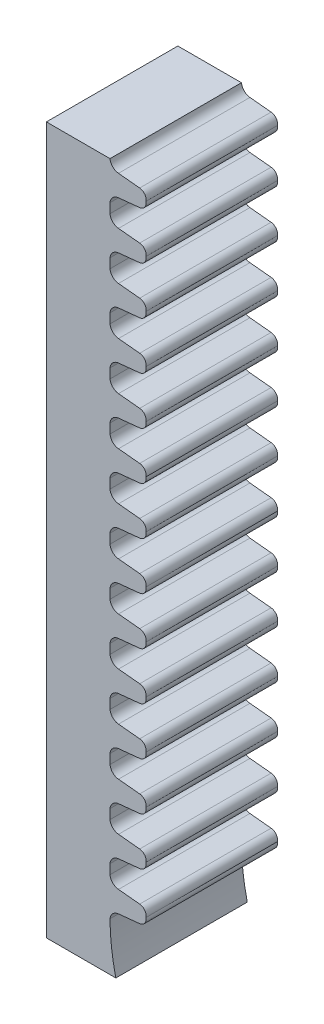
from build123d import *

# Parameters (mm, degrees)
BOSS_EXTRUDE1_DEPTH     = 6.2
BOSS_EXTRUDE3_DEPTH     = 6.2
CUT_EXTRUDE5_DEPTH      = 59.510170056
CUT_EXTRUDE5_DEPTH_BACK = 59.510170056
SKETCH9_W               = 8.426821026
SKETCH9_H               = 53.817918331
CUT_EXTRUDE6_DEPTH      = 56.427921054
CUT_EXTRUDE6_DEPTH_BACK = 56.427921054
SKETCH10_W              = 41.255234225
SKETCH10_H              = 19.128366746


with BuildPart() as part:
    # Sketch1 → Boss-Extrude1 (new body)
    with BuildSketch(Plane.XY):
        with BuildLine():
            Line((-28, 0), (0, 0))
            Line((0, 0), (0, 10))
            Line((0, 10), (-7.1, 10))
            ThreePointArc((-7.1, 10), (-14.171067812, 12.928932188), (-17.1, 20))
            Line((-17.1, 20), (-17.1, 51))
            Line((-17.1, 51), (-20.1, 51))
            Line((-20.1, 51), (-20.1, 6))
            Line((-20.1, 6), (-24, 6))
            Line((-24, 6), (-24, 50))
            Line((-24, 50), (-28, 50))
            Line((-28, 50), (-28, 0))
        make_face()
    extrude(amount=BOSS_EXTRUDE1_DEPTH)

    # Sketch7 → Boss-Extrude3 (add)
    with BuildSketch(Plane.XY.offset(6.2)):
        with BuildLine():
            Line((-16.7, 50.6), (-15.7, 50.5))
            ThreePointArc((-15.7, 50.5), (-15.462165524, 50.365875857), (-15.4, 50.1))
            ThreePointArc((-15.4, 50.1), (-15.462165524, 49.834124143), (-15.7, 49.7))
            Line((-15.7, 49.7), (-16.7, 49.6))
            ThreePointArc((-16.7, 49.6), (-16.971392676, 49.471392676), (-17.1, 49.2))
            Line((-17.1, 49.2), (-17.1, 48.75))
            ThreePointArc((-17.1, 48.75), (-16.971392676, 48.478607324), (-16.7, 48.35))
            Line((-16.7, 48.35), (-15.7, 48.25))
            ThreePointArc((-15.7, 48.25), (-15.462165524, 48.115875857), (-15.4, 47.85))
            ThreePointArc((-15.4, 47.85), (-15.462165524, 47.584124143), (-15.7, 47.45))
            Line((-15.7, 47.45), (-16.7, 47.35))
            ThreePointArc((-16.7, 47.35), (-16.971392676, 47.221392676), (-17.1, 46.95))
            Line((-17.1, 46.95), (-17.1, 46.5))
            ThreePointArc((-17.1, 46.5), (-16.971392676, 46.228607324), (-16.7, 46.1))
            Line((-16.7, 46.1), (-15.7, 46))
            ThreePointArc((-15.7, 46), (-15.462165524, 45.865875857), (-15.4, 45.6))
            ThreePointArc((-15.4, 45.6), (-15.462165524, 45.334124143), (-15.7, 45.2))
            Line((-15.7, 45.2), (-16.7, 45.1))
            ThreePointArc((-16.7, 45.1), (-16.971392676, 44.971392676), (-17.1, 44.7))
            Line((-17.1, 44.7), (-17.1, 44.25))
            ThreePointArc((-17.1, 44.25), (-16.971392676, 43.978607324), (-16.7, 43.85))
            Line((-16.7, 43.85), (-15.7, 43.75))
            ThreePointArc((-15.7, 43.75), (-15.462165524, 43.615875857), (-15.4, 43.35))
            ThreePointArc((-15.4, 43.35), (-15.462165524, 43.084124143), (-15.7, 42.95))
            Line((-15.7, 42.95), (-16.7, 42.85))
            ThreePointArc((-16.7, 42.85), (-16.971392676, 42.721392676), (-17.1, 42.45))
            Line((-17.1, 42.45), (-17.1, 42))
            ThreePointArc((-17.1, 42), (-16.971392676, 41.728607324), (-16.7, 41.6))
            Line((-16.7, 41.6), (-15.7, 41.5))
            ThreePointArc((-15.7, 41.5), (-15.462165524, 41.365875857), (-15.4, 41.1))
            ThreePointArc((-15.4, 41.1), (-15.462165524, 40.834124143), (-15.7, 40.7))
            Line((-15.7, 40.7), (-16.7, 40.6))
            ThreePointArc((-16.7, 40.6), (-16.971392676, 40.471392676), (-17.1, 40.2))
            Line((-17.1, 40.2), (-17.1, 39.75))
            ThreePointArc((-17.1, 39.75), (-16.971392676, 39.478607324), (-16.7, 39.35))
            Line((-16.7, 39.35), (-15.7, 39.25))
            ThreePointArc((-15.7, 39.25), (-15.462165524, 39.115875857), (-15.4, 38.85))
            ThreePointArc((-15.4, 38.85), (-15.462165524, 38.584124143), (-15.7, 38.45))
            Line((-15.7, 38.45), (-16.7, 38.35))
            ThreePointArc((-16.7, 38.35), (-16.971392676, 38.221392676), (-17.1, 37.95))
            Line((-17.1, 37.95), (-17.1, 37.5))
            ThreePointArc((-17.1, 37.5), (-16.971392676, 37.228607324), (-16.7, 37.1))
            Line((-16.7, 37.1), (-15.7, 37))
            ThreePointArc((-15.7, 37), (-15.462165524, 36.865875857), (-15.4, 36.6))
            ThreePointArc((-15.4, 36.6), (-15.462165524, 36.334124143), (-15.7, 36.2))
            Line((-15.7, 36.2), (-16.7, 36.1))
            ThreePointArc((-16.7, 36.1), (-16.971392676, 35.971392676), (-17.1, 35.7))
            Line((-17.1, 35.7), (-17.1, 35.25))
            ThreePointArc((-17.1, 35.25), (-16.971392676, 34.978607324), (-16.7, 34.85))
            Line((-16.7, 34.85), (-15.7, 34.75))
            ThreePointArc((-15.7, 34.75), (-15.462165524, 34.615875857), (-15.4, 34.35))
            ThreePointArc((-15.4, 34.35), (-15.462165524, 34.084124143), (-15.7, 33.95))
            Line((-15.7, 33.95), (-16.7, 33.85))
            ThreePointArc((-16.7, 33.85), (-16.971392676, 33.721392676), (-17.1, 33.45))
            Line((-17.1, 33.45), (-17.1, 33))
            ThreePointArc((-17.1, 33), (-16.971392676, 32.728607324), (-16.7, 32.6))
            Line((-16.7, 32.6), (-15.7, 32.5))
            ThreePointArc((-15.7, 32.5), (-15.462165524, 32.365875857), (-15.4, 32.1))
            ThreePointArc((-15.4, 32.1), (-15.462165524, 31.834124143), (-15.7, 31.7))
            Line((-15.7, 31.7), (-16.7, 31.6))
            ThreePointArc((-16.7, 31.6), (-16.971392676, 31.471392676), (-17.1, 31.2))
            Line((-17.1, 31.2), (-17.1, 30.75))
            ThreePointArc((-17.1, 30.75), (-16.971392676, 30.478607324), (-16.7, 30.35))
            Line((-16.7, 30.35), (-15.7, 30.25))
            ThreePointArc((-15.7, 30.25), (-15.462165524, 30.115875857), (-15.4, 29.85))
            ThreePointArc((-15.4, 29.85), (-15.462165524, 29.584124143), (-15.7, 29.45))
            Line((-15.7, 29.45), (-16.7, 29.35))
            ThreePointArc((-16.7, 29.35), (-16.971392676, 29.221392676), (-17.1, 28.95))
            Line((-17.1, 28.95), (-17.1, 28.5))
            ThreePointArc((-17.1, 28.5), (-16.971392676, 28.228607324), (-16.7, 28.1))
            Line((-16.7, 28.1), (-15.7, 28))
            ThreePointArc((-15.7, 28), (-15.462165524, 27.865875857), (-15.4, 27.6))
            ThreePointArc((-15.4, 27.6), (-15.462165524, 27.334124143), (-15.7, 27.2))
            Line((-15.7, 27.2), (-16.7, 27.1))
            ThreePointArc((-16.7, 27.1), (-16.971392676, 26.971392676), (-17.1, 26.7))
            Line((-17.1, 26.7), (-17.1, 26.25))
            ThreePointArc((-17.1, 26.25), (-16.971392676, 25.978607324), (-16.7, 25.85))
            Line((-16.7, 25.85), (-15.7, 25.75))
            ThreePointArc((-15.7, 25.75), (-15.462165524, 25.615875857), (-15.4, 25.35))
            ThreePointArc((-15.4, 25.35), (-15.462165524, 25.084124143), (-15.7, 24.95))
            Line((-15.7, 24.95), (-16.7, 24.85))
            ThreePointArc((-16.7, 24.85), (-16.971392676, 24.721392676), (-17.1, 24.45))
            Line((-17.1, 24.45), (-17.1, 24))
            ThreePointArc((-17.1, 24), (-16.971392676, 23.728607324), (-16.7, 23.6))
            Line((-16.7, 23.6), (-15.7, 23.5))
            ThreePointArc((-15.7, 23.5), (-15.462165524, 23.365875857), (-15.4, 23.1))
            ThreePointArc((-15.4, 23.1), (-15.462165524, 22.834124143), (-15.7, 22.7))
            Line((-15.7, 22.7), (-16.7, 22.6))
            ThreePointArc((-16.7, 22.6), (-16.971392676, 22.471392676), (-17.1, 22.2))
            Line((-17.1, 22.2), (-17.1, 21.75))
            ThreePointArc((-17.1, 21.75), (-16.971392676, 21.478607324), (-16.7, 21.35))
            Line((-16.7, 21.35), (-15.7, 21.25))
            ThreePointArc((-15.7, 21.25), (-15.462165524, 21.115875857), (-15.4, 20.85))
            ThreePointArc((-15.4, 20.85), (-15.462165524, 20.584124143), (-15.7, 20.45))
            Line((-15.7, 20.45), (-16.7, 20.35))
            ThreePointArc((-16.7, 20.35), (-16.971392676, 20.221392676), (-17.1, 19.95))
            Line((-17.1, 19.95), (-17.956542174, 50.55))
            Line((-17.956542174, 50.55), (-17.1, 51))
            ThreePointArc((-17.1, 51), (-16.971392676, 50.728607324), (-16.7, 50.6))
        make_face()
    extrude(amount=-BOSS_EXTRUDE3_DEPTH)

    # Sketch9 → Cut-Extrude5 (cut, two sides: drawn at the far end of the back side and taken through both)
    with BuildSketch(Plane.XY.offset(6.2).offset(-CUT_EXTRUDE5_DEPTH_BACK)):
        with Locations((-25.017603177, 24.82792225)):
            Rectangle(SKETCH9_W, SKETCH9_H)
    extrude(amount=CUT_EXTRUDE5_DEPTH + CUT_EXTRUDE5_DEPTH_BACK, mode=Mode.SUBTRACT)

    # Sketch10 → Cut-Extrude6 (cut, two sides: drawn at the far end of the back side and taken through both)
    with BuildSketch(Plane.XY.offset(6.2).offset(-CUT_EXTRUDE6_DEPTH_BACK)):
        with Locations((-9.089657701, 8.103525919)):
            Rectangle(SKETCH10_W, SKETCH10_H)
    extrude(amount=CUT_EXTRUDE6_DEPTH + CUT_EXTRUDE6_DEPTH_BACK, mode=Mode.SUBTRACT)


solid = part.part
